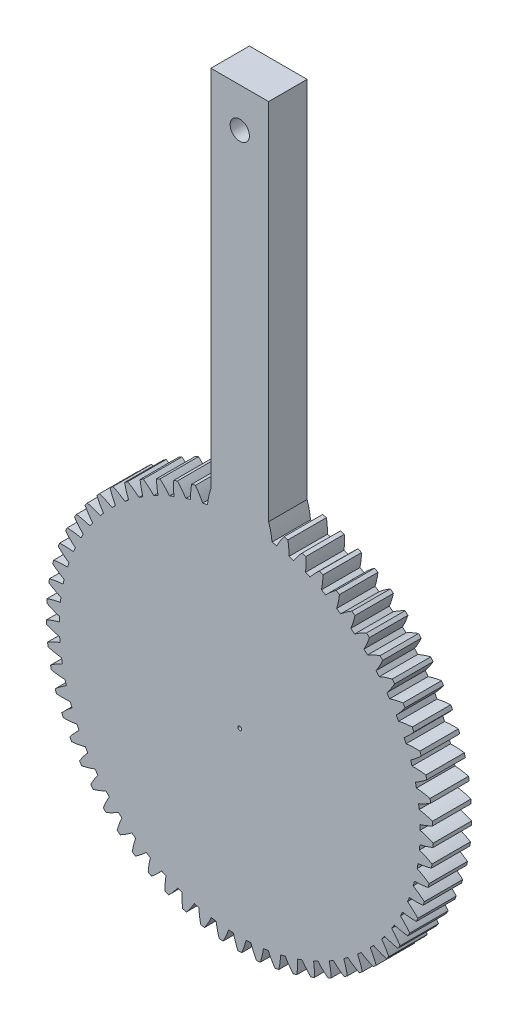
from build123d import *

# Parameters (mm, degrees)
BOSS_EXTRUDE1_DEPTH = 10
CUT_EXTRUDE1_REACH  = 155.606
SKETCH2_R           = 2.5
SKETCH2_R_2         = 0.5


with BuildPart() as part:
    # Sketch1 → Boss-Extrude1 (new body)
    with BuildSketch(Plane.XY):
        with BuildLine():
            Line((-7.5, 144.81), (7.5, 144.81))
            Line((7.5, 144.81), (7.5, 50.251922588))
            ThreePointArc((7.5, 50.251922588), (8.05756043, 48.210693144), (8.390751982, 46.121082016))
            ThreePointArc((8.390751982, 46.121082016), (9.006540931, 46.004794811), (9.62072035, 45.880286236))
            ThreePointArc((9.62072035, 45.880286236), (10.510177242, 47.43980562), (11.539242295, 48.910947825))
            ThreePointArc((11.539242295, 48.910947825), (12.026498947, 48.79342428), (12.512559199, 48.671046755))
            ThreePointArc((12.512559199, 48.671046755), (12.74007718, 46.890184649), (12.802907349, 45.095947585))
            ThreePointArc((12.802907349, 45.095947585), (13.404598236, 44.920771045), (14.00389363, 44.737566858))
            ThreePointArc((14.00389363, 44.737566858), (15.039713543, 46.203960864), (16.205960247, 47.568916136))
            ThreePointArc((16.205960247, 47.568916136), (16.679599549, 47.404914184), (17.15157956, 47.236196381))
            ThreePointArc((17.15157956, 47.236196381), (17.206157418, 45.441689337), (17.09552542, 43.649764441))
            ThreePointArc((17.09552542, 43.649764441), (17.677500419, 43.417334143), (18.256316329, 43.177144872))
            ThreePointArc((18.256316329, 43.177144872), (19.428828091, 44.536722173), (20.721367515, 45.782746294))
            ThreePointArc((20.721367515, 45.782746294), (21.176967224, 45.573797177), (21.630460243, 45.360314368))
            ThreePointArc((21.630460243, 45.360314368), (21.511588401, 43.568917216), (21.228527176, 41.796035208))
            ThreePointArc((21.228527176, 41.796035208), (21.785352544, 41.50852129), (22.338284721, 41.213589517))
            ThreePointArc((22.338284721, 41.213589517), (23.636540906, 42.453656108), (25.043304958, 43.569115285))
            ThreePointArc((25.043304958, 43.569115285), (25.476611262, 43.317169905), (25.907383147, 43.060915322))
            ThreePointArc((25.907383147, 43.060915322), (25.61617148, 41.289353854), (25.163323893, 39.552067656))
            ThreePointArc((25.163323893, 39.552067656), (25.689800701, 39.212154558), (26.211686568, 38.865233982))
            ThreePointArc((26.211686568, 38.865233982), (27.623565707, 39.974211694), (29.131419809, 40.948691186))
            ThreePointArc((29.131419809, 40.948691186), (29.538387045, 40.656101888), (29.942415795, 40.359468112))
            ThreePointArc((29.942415795, 40.359468112), (29.481583266, 38.62428292), (28.863177435, 36.938813104))
            ThreePointArc((28.863177435, 36.938813104), (29.354390112, 36.549674504), (29.840356959, 36.154004228))
            ThreePointArc((29.840356959, 36.154004228), (31.352676718, 37.121538836), (32.947542443, 37.94594019))
            ThreePointArc((32.947542443, 37.94594019), (33.324370866, 37.615438802), (33.697884174, 37.281195422))
            ThreePointArc((33.697884174, 37.281195422), (33.071733454, 35.598587462), (32.293543266, 33.980670807))
            ThreePointArc((32.293543266, 33.980670807), (32.744905491, 33.545939987), (33.190415977, 33.105214279))
            ThreePointArc((33.190415977, 33.105214279), (34.789056234, 33.922272171), (36.45604275, 34.588898174))
            ThreePointArc((36.45604275, 34.588898174), (36.799214016, 34.223570499), (37.138724488, 33.854838256))
            ThreePointArc((37.138724488, 33.854838256), (36.353101776, 32.240517585), (35.422392985, 30.705260142))
            ThreePointArc((35.422392985, 30.705260142), (35.829690509, 30.228996066), (36.230585024, 29.747329863))
            ThreePointArc((36.230585024, 29.747329863), (37.900619706, 30.406282392), (39.624162809, 30.908908936))
            ThreePointArc((39.624162809, 30.908908936), (39.930472819, 30.51216594), (40.232810538, 30.112387586))
            ThreePointArc((40.232810538, 30.112387586), (39.295050983, 28.581426683), (38.220513364, 27.143162737))
            ThreePointArc((38.220513364, 27.143162737), (38.579943362, 26.629812154), (38.932478861, 26.111702643))
            ThreePointArc((38.932478861, 26.111702643), (40.658315302, 26.606397346), (42.422322735, 26.940331543))
            ThreePointArc((42.422322735, 26.940331543), (42.688911557, 26.515877508), (42.951253676, 26.088785667))
            ThreePointArc((42.951253676, 26.088785667), (41.870112885, 24.6554787), (40.661779108, 23.327636934))
            ThreePointArc((40.661779108, 23.327636934), (40.969985678, 22.781992861), (41.270870632, 22.232277491))
            ThreePointArc((41.270870632, 22.232277491), (43.036395164, 22.558095536), (44.824396865, 22.720219533))
            ThreePointArc((44.824396865, 22.720219533), (45.048775429, 22.272017472), (45.268672531, 21.821599785))
            ThreePointArc((45.268672531, 21.821599785), (44.054244825, 20.499329155), (42.723396777, 19.29430727))
            ThreePointArc((42.723396777, 19.29430727), (42.977502276, 18.721464239), (43.223927404, 18.145275555))
            ThreePointArc((43.223927404, 18.145275555), (45.0126558, 18.299174867), (46.807957678, 18.287974955))
            ThreePointArc((46.807957678, 18.287974955), (46.988031023, 17.82020961), (47.163429988, 17.350671506))
            ThreePointArc((47.163429988, 17.350671506), (45.827054151, 16.151782898), (44.3861176, 15.080831859))
            ThreePointArc((44.3861176, 15.080831859), (44.583749516, 14.48613835), (44.773414012, 13.888856069))
            ThreePointArc((44.773414012, 13.888856069), (46.568645396, 13.869399732), (48.354485202, 13.684980482))
            ThreePointArc((48.354485202, 13.684980482), (48.488572031, 13.202019252), (48.617835206, 12.717744682))
            ThreePointArc((48.617835206, 12.717744682), (47.17198862, 11.653431795), (45.634417203, 10.726550783))
            ThreePointArc((45.634417203, 10.726550783), (45.773730298, 10.115559289), (45.904863316, 9.502760077))
            ThreePointArc((45.904863316, 9.502760077), (47.689836097, 9.310129749), (49.449539926, 8.954213034))
            ThreePointArc((49.449539926, 8.954213034), (49.536388307, 8.460565197), (49.618308797, 7.966075702))
            ThreePointArc((49.618308797, 7.966075702), (48.07649094, 7.04627574), (46.456640548, 6.272118793))
            ThreePointArc((46.456640548, 6.272118793), (46.536334094, 5.650533978), (46.607711281, 5.027939374))
            ThreePointArc((46.607711281, 5.027939374), (48.365759649, 4.663933593), (50.082897619, 4.139842511))
            ThreePointArc((50.082897619, 4.139842511), (50.121696672, 3.640117125), (50.155509607, 3.140029619))
            ThreePointArc((50.155509607, 3.140029619), (48.532116019, 2.373330506), (46.845110757, 1.759125719))
            ThreePointArc((46.845110757, 1.759125719), (46.864440677, 1.132751153), (46.875395603, 0.506174156))
            ThreePointArc((46.875395603, 0.506174156), (48.590105133, -0.025808454), (50.248644791, -0.713180606))
            ThreePointArc((50.248644791, -0.713180606), (50.239032259, -1.21431774), (50.224421937, -1.715334074))
            ThreePointArc((50.224421937, -1.715334074), (48.534609806, -2.321773875), (46.796200789, -2.770291837))
            ThreePointArc((46.796200789, -2.770291837), (46.754986605, -3.395607865), (46.705416986, -4.020317074))
            ThreePointArc((46.705416986, -4.020317074), (48.360777898, -4.715309535), (49.945233906, -5.559544948))
            ThreePointArc((49.945233906, -5.559544948), (49.887299539, -6.057414848), (49.824402373, -6.554682154))
            ThreePointArc((49.824402373, -6.554682154), (48.083949018, -6.995200479), (46.310367303, -7.273843925))
            ThreePointArc((46.310367303, -7.273843925), (46.20899382, -7.892263006), (46.099362474, -8.509271687))
            ThreePointArc((46.099362474, -8.509271687), (47.67991911, -9.360785041), (49.175497828, -10.354001317))
            ThreePointArc((49.175497828, -10.354001317), (49.069782544, -10.843955505), (48.959185787, -11.332830934))
            ThreePointArc((48.959185787, -11.332830934), (47.184341354, -11.603314781), (45.392146395, -11.709482092))
            ThreePointArc((45.392146395, -11.709482092), (45.231560109, -12.315230215), (45.062890636, -12.918777522))
            ThreePointArc((45.062890636, -12.918777522), (46.553885764, -13.918861419), (47.946623377, -15.051785165))
            ThreePointArc((47.946623377, -15.051785165), (47.794114211, -15.529249071), (47.636850476, -16.005168125))
            ThreePointArc((47.636850476, -16.005168125), (45.844186208, -16.103092059), (44.050111246, -16.035791979))
            ThreePointArc((44.050111246, -16.035791979), (43.83181151, -16.623213437), (43.60567873, -17.207664213))
            ThreePointArc((43.60567873, -17.207664213), (44.99319133, -18.346981139), (46.270084222, -19.60903455))
            ThreePointArc((46.270084222, -19.60903455), (46.072205111, -20.069550223), (45.869742726, -20.528069373))
            ThreePointArc((45.869742726, -20.528069373), (44.075996248, -20.452519105), (42.296792077, -20.212379998))
            ThreePointArc((42.296792077, -20.212379998), (42.022817095, -20.775990194), (41.74133235, -21.335887579))
            ThreePointArc((41.74133235, -21.335887579), (43.012407591, -22.603800039), (44.161533758, -23.983199663))
            ThreePointArc((44.161533758, -23.983199663), (43.920132245, -24.422467392), (43.674361548, -24.859305568))
            ThreePointArc((43.674361548, -24.859305568), (41.896280586, -24.610986491), (40.148559157, -24.20025047))
            ThreePointArc((40.148559157, -24.20025047), (39.82146696, -24.734787128), (39.487258397, -25.264903512))
            ThreePointArc((39.487258397, -25.264903512), (40.630028591, -26.649573348), (41.640658951, -28.133440103))
            ThreePointArc((41.640658951, -28.133440103), (41.357988938, -28.547358563), (41.071204623, -28.958437126))
            ThreePointArc((41.071204623, -28.958437126), (39.32539064, -28.539667727), (37.625469957, -27.962169725))
            ThreePointArc((37.625469957, -27.962169725), (37.248314518, -28.46264202), (36.864502551, -28.958027847))
            ThreePointArc((36.864502551, -28.958027847), (37.868297962, -30.446526771), (38.730996531, -32.021006193))
            ThreePointArc((38.730996531, -32.021006193), (38.409697232, -32.405710739), (38.084576927, -32.787191558))
            ThreePointArc((38.084576927, -32.787191558), (36.387330118, -32.201881775), (34.751081882, -31.463013734))
            ThreePointArc((34.751081882, -31.463013734), (34.327384599, -31.924748892), (33.897552778, -32.380778879))
            ThreePointArc((33.897552778, -32.380778879), (34.753001237, -33.959209177), (35.459713233, -35.609600775))
            ThreePointArc((35.459713233, -35.609600775), (35.102784531, -35.961499525), (34.742363797, -36.309820817))
            ThreePointArc((34.742363797, -36.309820817), (33.109530898, -35.563435529), (31.552232318, -34.670096061))
            ThreePointArc((31.552232318, -34.670096061), (31.085949138, -35.088782985), (30.614110688, -35.501199303))
            ThreePointArc((30.614110688, -35.501199303), (31.313225104, -37.154823597), (31.857352145, -38.86571811))
            ThreePointArc((31.857352145, -38.86571811), (31.468126589, -39.181525479), (31.075770577, -39.493435062))
            ThreePointArc((31.075770577, -39.493435062), (29.522596909, -38.592943068), (28.058788063, -37.553473043))
            ThreePointArc((28.058788063, -37.553473043), (27.554272547, -37.925202565), (27.044832894, -38.290154595))
            ThreePointArc((27.044832894, -38.290154595), (27.581085825, -40.00353344), (27.957547545, -41.758956706))
            ThreePointArc((27.957547545, -41.758956706), (27.539659228, -42.035724087), (27.11903126, -42.308309744))
            ThreePointArc((27.11903126, -42.308309744), (25.660018388, -41.262118696), (24.303366464, -40.086223366))
            ThreePointArc((24.303366464, -40.086223366), (23.765329136, -40.407524747), (23.223044783, -40.72160503))
            ThreePointArc((23.223044783, -40.72160503), (23.591429379, -42.478741069), (23.796710855, -44.262303175))
            ThreePointArc((23.796710855, -44.262303175), (23.354061489, -44.497446465), (22.909088856, -44.728163138))
            ThreePointArc((22.909088856, -44.728163138), (21.557859188, -43.546041039), (20.32103088, -42.244699421))
            ThreePointArc((20.32103088, -42.244699421), (19.754495251, -42.512572759), (19.18442936, -42.77284881))
            ThreePointArc((19.18442936, -42.77284881), (19.381506113, -44.557336138), (19.413690688, -46.352384446))
            ThreePointArc((19.413690688, -46.352384446), (18.95041317, -46.543708174), (18.485250461, -46.730401724))
            ThreePointArc((18.485250461, -46.730401724), (17.254420066, -45.42338573), (16.148963306, -44.0087481))
            ThreePointArc((16.148963306, -44.0087481), (15.559218966, -44.220692332), (14.966694088, -44.424734026))
            ThreePointArc((14.966694088, -44.424734026), (14.990622946, -46.219911365), (14.849410122, -48.009685991))
            ThreePointArc((14.849410122, -48.009685991), (14.369829949, -48.155403821), (13.888820263, -48.29633114))
            ThreePointArc((13.888820263, -48.29633114), (12.789881072, -46.876624506), (11.826117212, -45.361898956))
            ThreePointArc((11.826117212, -45.361898956), (11.218670446, -45.515935216), (10.609218827, -45.661837469))
            ThreePointArc((10.609218827, -45.661837469), (10.459776372, -47.450943733), (10.146484615, -49.218734034))
            ThreePointArc((10.146484615, -49.218734034), (9.655079498, -49.317485437), (9.162713893, -49.411330725))
            ThreePointArc((9.162713893, -49.411330725), (8.205926405, -47.89218887), (7.392853849, -46.291517983))
            ThreePointArc((7.392853849, -46.291517983), (6.773376223, -46.386208077), (6.152688148, -46.472608639))
            ThreePointArc((6.152688148, -46.472608639), (5.831269685, -48.238939425), (5.348824114, -49.968240018))
            ThreePointArc((5.348824114, -49.968240018), (4.850182171, -50.019102979), (4.351057731, -50.064990028))
            ThreePointArc((4.351057731, -50.064990028), (3.545355214, -48.460596771), (2.890565401, -46.788925579))
            ThreePointArc((2.890565401, -46.788925579), (2.26484081, -46.82338541), (1.638711477, -46.849477584))
            ThreePointArc((1.638711477, -46.849477584), (1.148318003, -48.576541136), (0.501223084, -50.251206009))
            ThreePointArc((0.501223084, -50.251206009), (0, -50.253705634), (-0.501223084, -50.251206009))
            ThreePointArc((-0.501223084, -50.251206009), (-1.148318003, -48.576541136), (-1.638711477, -46.849477584))
            ThreePointArc((-1.638711477, -46.849477584), (-2.26484081, -46.82338541), (-2.890565401, -46.788925579))
            ThreePointArc((-2.890565401, -46.788925579), (-3.545355214, -48.460596771), (-4.351057731, -50.064990028))
            ThreePointArc((-4.351057731, -50.064990028), (-4.850182171, -50.019102979), (-5.348824114, -49.968240018))
            ThreePointArc((-5.348824114, -49.968240018), (-5.831269685, -48.238939425), (-6.152688148, -46.472608639))
            ThreePointArc((-6.152688148, -46.472608639), (-6.773376223, -46.386208077), (-7.392853849, -46.291517983))
            ThreePointArc((-7.392853849, -46.291517983), (-8.205926405, -47.89218887), (-9.162713893, -49.411330725))
            ThreePointArc((-9.162713893, -49.411330725), (-9.655079498, -49.317485437), (-10.146484615, -49.218734034))
            ThreePointArc((-10.146484615, -49.218734034), (-10.459776372, -47.450943733), (-10.609218827, -45.661837469))
            ThreePointArc((-10.609218827, -45.661837469), (-11.218670446, -45.515935216), (-11.826117212, -45.361898956))
            ThreePointArc((-11.826117212, -45.361898956), (-12.789881072, -46.876624506), (-13.888820263, -48.29633114))
            ThreePointArc((-13.888820263, -48.29633114), (-14.369829949, -48.155403821), (-14.849410122, -48.009685991))
            ThreePointArc((-14.849410122, -48.009685991), (-14.990622946, -46.219911365), (-14.966694088, -44.424734026))
            ThreePointArc((-14.966694088, -44.424734026), (-15.559218966, -44.220692332), (-16.148963306, -44.0087481))
            ThreePointArc((-16.148963306, -44.0087481), (-17.254420066, -45.42338573), (-18.485250461, -46.730401724))
            ThreePointArc((-18.485250461, -46.730401724), (-18.95041317, -46.543708174), (-19.413690688, -46.352384446))
            ThreePointArc((-19.413690688, -46.352384446), (-19.381506113, -44.557336138), (-19.18442936, -42.77284881))
            ThreePointArc((-19.18442936, -42.77284881), (-19.754495251, -42.512572759), (-20.32103088, -42.244699421))
            ThreePointArc((-20.32103088, -42.244699421), (-21.557859188, -43.546041039), (-22.909088856, -44.728163138))
            ThreePointArc((-22.909088856, -44.728163138), (-23.354061489, -44.497446465), (-23.796710855, -44.262303175))
            ThreePointArc((-23.796710855, -44.262303175), (-23.591429379, -42.478741069), (-23.223044783, -40.72160503))
            ThreePointArc((-23.223044783, -40.72160503), (-23.765329136, -40.407524747), (-24.303366464, -40.086223366))
            ThreePointArc((-24.303366464, -40.086223366), (-25.660018388, -41.262118696), (-27.11903126, -42.308309744))
            ThreePointArc((-27.11903126, -42.308309744), (-27.539659228, -42.035724087), (-27.957547545, -41.758956706))
            ThreePointArc((-27.957547545, -41.758956706), (-27.581085825, -40.00353344), (-27.044832894, -38.290154595))
            ThreePointArc((-27.044832894, -38.290154595), (-27.554272547, -37.925202565), (-28.058788063, -37.553473043))
            ThreePointArc((-28.058788063, -37.553473043), (-29.522596909, -38.592943068), (-31.075770577, -39.493435062))
            ThreePointArc((-31.075770577, -39.493435062), (-31.468126589, -39.181525479), (-31.857352145, -38.86571811))
            ThreePointArc((-31.857352145, -38.86571811), (-31.313225104, -37.154823597), (-30.614110688, -35.501199303))
            ThreePointArc((-30.614110688, -35.501199303), (-31.085949138, -35.088782985), (-31.552232318, -34.670096061))
            ThreePointArc((-31.552232318, -34.670096061), (-33.109530898, -35.563435529), (-34.742363797, -36.309820817))
            ThreePointArc((-34.742363797, -36.309820817), (-35.102784531, -35.961499525), (-35.459713233, -35.609600775))
            ThreePointArc((-35.459713233, -35.609600775), (-34.753001237, -33.959209177), (-33.897552778, -32.380778879))
            ThreePointArc((-33.897552778, -32.380778879), (-34.327384599, -31.924748892), (-34.751081882, -31.463013734))
            ThreePointArc((-34.751081882, -31.463013734), (-36.387330118, -32.201881775), (-38.084576927, -32.787191558))
            ThreePointArc((-38.084576927, -32.787191558), (-38.409697232, -32.405710739), (-38.730996531, -32.021006193))
            ThreePointArc((-38.730996531, -32.021006193), (-37.868297962, -30.446526771), (-36.864502551, -28.958027847))
            ThreePointArc((-36.864502551, -28.958027847), (-37.248314518, -28.46264202), (-37.625469957, -27.962169725))
            ThreePointArc((-37.625469957, -27.962169725), (-39.32539064, -28.539667727), (-41.071204623, -28.958437126))
            ThreePointArc((-41.071204623, -28.958437126), (-41.357988938, -28.547358563), (-41.640658951, -28.133440103))
            ThreePointArc((-41.640658951, -28.133440103), (-40.630028591, -26.649573348), (-39.487258397, -25.264903512))
            ThreePointArc((-39.487258397, -25.264903512), (-39.82146696, -24.734787128), (-40.148559157, -24.20025047))
            ThreePointArc((-40.148559157, -24.20025047), (-41.896280586, -24.610986491), (-43.674361548, -24.859305568))
            ThreePointArc((-43.674361548, -24.859305568), (-43.920132245, -24.422467392), (-44.161533758, -23.983199663))
            ThreePointArc((-44.161533758, -23.983199663), (-43.012407591, -22.603800039), (-41.74133235, -21.335887579))
            ThreePointArc((-41.74133235, -21.335887579), (-42.022817095, -20.775990194), (-42.296792077, -20.212379998))
            ThreePointArc((-42.296792077, -20.212379998), (-44.075996248, -20.452519105), (-45.869742726, -20.528069373))
            ThreePointArc((-45.869742726, -20.528069373), (-46.072205111, -20.069550223), (-46.270084222, -19.60903455))
            ThreePointArc((-46.270084222, -19.60903455), (-44.99319133, -18.346981139), (-43.60567873, -17.207664213))
            ThreePointArc((-43.60567873, -17.207664213), (-43.83181151, -16.623213437), (-44.050111246, -16.035791979))
            ThreePointArc((-44.050111246, -16.035791979), (-45.844186208, -16.103092059), (-47.636850476, -16.005168125))
            ThreePointArc((-47.636850476, -16.005168125), (-47.794114211, -15.529249071), (-47.946623377, -15.051785165))
            ThreePointArc((-47.946623377, -15.051785165), (-46.553885764, -13.918861419), (-45.062890636, -12.918777522))
            ThreePointArc((-45.062890636, -12.918777522), (-45.231560109, -12.315230215), (-45.392146395, -11.709482092))
            ThreePointArc((-45.392146395, -11.709482092), (-47.184341354, -11.603314781), (-48.959185787, -11.332830934))
            ThreePointArc((-48.959185787, -11.332830934), (-49.069782544, -10.843955505), (-49.175497828, -10.354001317))
            ThreePointArc((-49.175497828, -10.354001317), (-47.67991911, -9.360785041), (-46.099362474, -8.509271687))
            ThreePointArc((-46.099362474, -8.509271687), (-46.20899382, -7.892263006), (-46.310367303, -7.273843925))
            ThreePointArc((-46.310367303, -7.273843925), (-48.083949018, -6.995200479), (-49.824402373, -6.554682154))
            ThreePointArc((-49.824402373, -6.554682154), (-49.887299539, -6.057414848), (-49.945233906, -5.559544948))
            ThreePointArc((-49.945233906, -5.559544948), (-48.360777898, -4.715309535), (-46.705416986, -4.020317074))
            ThreePointArc((-46.705416986, -4.020317074), (-46.754986605, -3.395607865), (-46.796200789, -2.770291837))
            ThreePointArc((-46.796200789, -2.770291837), (-48.534609806, -2.321773875), (-50.224421937, -1.715334074))
            ThreePointArc((-50.224421937, -1.715334074), (-50.239032259, -1.21431774), (-50.248644791, -0.713180606))
            ThreePointArc((-50.248644791, -0.713180606), (-48.590105133, -0.025808454), (-46.875395603, 0.506174156))
            ThreePointArc((-46.875395603, 0.506174156), (-46.864440677, 1.132751153), (-46.845110757, 1.759125719))
            ThreePointArc((-46.845110757, 1.759125719), (-48.532116019, 2.373330506), (-50.155509607, 3.140029619))
            ThreePointArc((-50.155509607, 3.140029619), (-50.121696672, 3.640117125), (-50.082897619, 4.139842511))
            ThreePointArc((-50.082897619, 4.139842511), (-48.365759649, 4.663933593), (-46.607711281, 5.027939374))
            ThreePointArc((-46.607711281, 5.027939374), (-46.536334094, 5.650533978), (-46.456640548, 6.272118793))
            ThreePointArc((-46.456640548, 6.272118793), (-48.07649094, 7.04627574), (-49.618308797, 7.966075702))
            ThreePointArc((-49.618308797, 7.966075702), (-49.536388307, 8.460565197), (-49.449539926, 8.954213034))
            ThreePointArc((-49.449539926, 8.954213034), (-47.689836097, 9.310129749), (-45.904863316, 9.502760077))
            ThreePointArc((-45.904863316, 9.502760077), (-45.773730298, 10.115559289), (-45.634417203, 10.726550783))
            ThreePointArc((-45.634417203, 10.726550783), (-47.17198862, 11.653431795), (-48.617835206, 12.717744682))
            ThreePointArc((-48.617835206, 12.717744682), (-48.488572031, 13.202019252), (-48.354485202, 13.684980482))
            ThreePointArc((-48.354485202, 13.684980482), (-46.568645396, 13.869399732), (-44.773414012, 13.888856069))
            ThreePointArc((-44.773414012, 13.888856069), (-44.583749516, 14.48613835), (-44.3861176, 15.080831859))
            ThreePointArc((-44.3861176, 15.080831859), (-45.827054151, 16.151782898), (-47.163429988, 17.350671506))
            ThreePointArc((-47.163429988, 17.350671506), (-46.988031023, 17.82020961), (-46.807957678, 18.287974955))
            ThreePointArc((-46.807957678, 18.287974955), (-45.0126558, 18.299174867), (-43.223927404, 18.145275555))
            ThreePointArc((-43.223927404, 18.145275555), (-42.977502276, 18.721464239), (-42.723396777, 19.29430727))
            ThreePointArc((-42.723396777, 19.29430727), (-44.054244825, 20.499329155), (-45.268672531, 21.821599785))
            ThreePointArc((-45.268672531, 21.821599785), (-45.048775429, 22.272017472), (-44.824396865, 22.720219533))
            ThreePointArc((-44.824396865, 22.720219533), (-43.036395164, 22.558095536), (-41.270870632, 22.232277491))
            ThreePointArc((-41.270870632, 22.232277491), (-40.969985678, 22.781992861), (-40.661779108, 23.327636934))
            ThreePointArc((-40.661779108, 23.327636934), (-41.870112885, 24.6554787), (-42.951253676, 26.088785667))
            ThreePointArc((-42.951253676, 26.088785667), (-42.688911557, 26.515877508), (-42.422322735, 26.940331543))
            ThreePointArc((-42.422322735, 26.940331543), (-40.658315302, 26.606397346), (-38.932478861, 26.111702643))
            ThreePointArc((-38.932478861, 26.111702643), (-38.579943362, 26.629812154), (-38.220513364, 27.143162737))
            ThreePointArc((-38.220513364, 27.143162737), (-39.295050983, 28.581426683), (-40.232810538, 30.112387586))
            ThreePointArc((-40.232810538, 30.112387586), (-39.930472819, 30.51216594), (-39.624162809, 30.908908936))
            ThreePointArc((-39.624162809, 30.908908936), (-37.900619706, 30.406282392), (-36.230585024, 29.747329863))
            ThreePointArc((-36.230585024, 29.747329863), (-35.829690509, 30.228996066), (-35.422392985, 30.705260142))
            ThreePointArc((-35.422392985, 30.705260142), (-36.353101776, 32.240517585), (-37.138724488, 33.854838256))
            ThreePointArc((-37.138724488, 33.854838256), (-36.799214016, 34.223570499), (-36.45604275, 34.588898174))
            ThreePointArc((-36.45604275, 34.588898174), (-34.789056234, 33.922272171), (-33.190415977, 33.105214279))
            ThreePointArc((-33.190415977, 33.105214279), (-32.744905491, 33.545939987), (-32.293543266, 33.980670807))
            ThreePointArc((-32.293543266, 33.980670807), (-33.071733454, 35.598587462), (-33.697884174, 37.281195422))
            ThreePointArc((-33.697884174, 37.281195422), (-33.324370866, 37.615438802), (-32.947542443, 37.94594019))
            ThreePointArc((-32.947542443, 37.94594019), (-31.352676718, 37.121538836), (-29.840356959, 36.154004228))
            ThreePointArc((-29.840356959, 36.154004228), (-29.354390112, 36.549674504), (-28.863177435, 36.938813104))
            ThreePointArc((-28.863177435, 36.938813104), (-29.481583266, 38.62428292), (-29.942415795, 40.359468112))
            ThreePointArc((-29.942415795, 40.359468112), (-29.538387045, 40.656101888), (-29.131419809, 40.948691186))
            ThreePointArc((-29.131419809, 40.948691186), (-27.623565707, 39.974211694), (-26.211686568, 38.865233982))
            ThreePointArc((-26.211686568, 38.865233982), (-25.689800701, 39.212154558), (-25.163323893, 39.552067656))
            ThreePointArc((-25.163323893, 39.552067656), (-25.61617148, 41.289353854), (-25.907383147, 43.060915322))
            ThreePointArc((-25.907383147, 43.060915322), (-25.476611262, 43.317169905), (-25.043304958, 43.569115285))
            ThreePointArc((-25.043304958, 43.569115285), (-23.636540906, 42.453656108), (-22.338284721, 41.213589517))
            ThreePointArc((-22.338284721, 41.213589517), (-21.785352544, 41.50852129), (-21.228527176, 41.796035208))
            ThreePointArc((-21.228527176, 41.796035208), (-21.511588401, 43.568917216), (-21.630460243, 45.360314368))
            ThreePointArc((-21.630460243, 45.360314368), (-21.176967224, 45.573797177), (-20.721367515, 45.782746294))
            ThreePointArc((-20.721367515, 45.782746294), (-19.428828091, 44.536722173), (-18.256316329, 43.177144872))
            ThreePointArc((-18.256316329, 43.177144872), (-17.677500419, 43.417334143), (-17.09552542, 43.649764441))
            ThreePointArc((-17.09552542, 43.649764441), (-17.206157419, 45.441689337), (-17.15157956, 47.236196381))
            ThreePointArc((-17.15157956, 47.236196381), (-16.679599549, 47.404914184), (-16.205960247, 47.568916136))
            ThreePointArc((-16.205960247, 47.568916136), (-15.039713543, 46.203960864), (-14.00389363, 44.737566858))
            ThreePointArc((-14.00389363, 44.737566858), (-13.404598236, 44.920771045), (-12.802907349, 45.095947585))
            ThreePointArc((-12.802907349, 45.095947585), (-12.74007718, 46.890184649), (-12.512559199, 48.671046755))
            ThreePointArc((-12.512559199, 48.671046755), (-12.026498947, 48.79342428), (-11.539242295, 48.910947825))
            ThreePointArc((-11.539242295, 48.910947825), (-10.510177242, 47.43980562), (-9.62072035, 45.880286236))
            ThreePointArc((-9.62072035, 45.880286236), (-9.006540931, 46.004794811), (-8.390751982, 46.121082016))
            ThreePointArc((-8.390751982, 46.121082016), (-8.05756043, 48.210693144), (-7.5, 50.251922588))
            Line((-7.5, 50.251922588), (-7.5, 144.81))
        make_face()
    extrude(amount=BOSS_EXTRUDE1_DEPTH)

    # Sketch2 → Cut-Extrude1 (cut, up to next)
    with BuildSketch(Plane.XY.offset(10), mode=Mode.PRIVATE) as cut_extrude1_sk1:
        with Locations((0, 134.62)):
            Circle(SKETCH2_R)
    cut_extrude1_tool1 = extrude(cut_extrude1_sk1.sketch, amount=-CUT_EXTRUDE1_REACH, mode=Mode.PRIVATE) & part.part
    # Sketch2 → Cut-Extrude1 (cut, up to next)
    with BuildSketch(Plane.XY.offset(10), mode=Mode.PRIVATE) as cut_extrude1_sk2:
        Circle(SKETCH2_R_2)
    cut_extrude1_tool2 = extrude(cut_extrude1_sk2.sketch, amount=-CUT_EXTRUDE1_REACH, mode=Mode.PRIVATE) & part.part
    add(cut_extrude1_tool1.solids().sort_by_distance((0, 134.62, 10))[0], mode=Mode.SUBTRACT)
    add(cut_extrude1_tool2.solids().sort_by_distance((0, 0, 10))[0], mode=Mode.SUBTRACT)


solid = part.part
